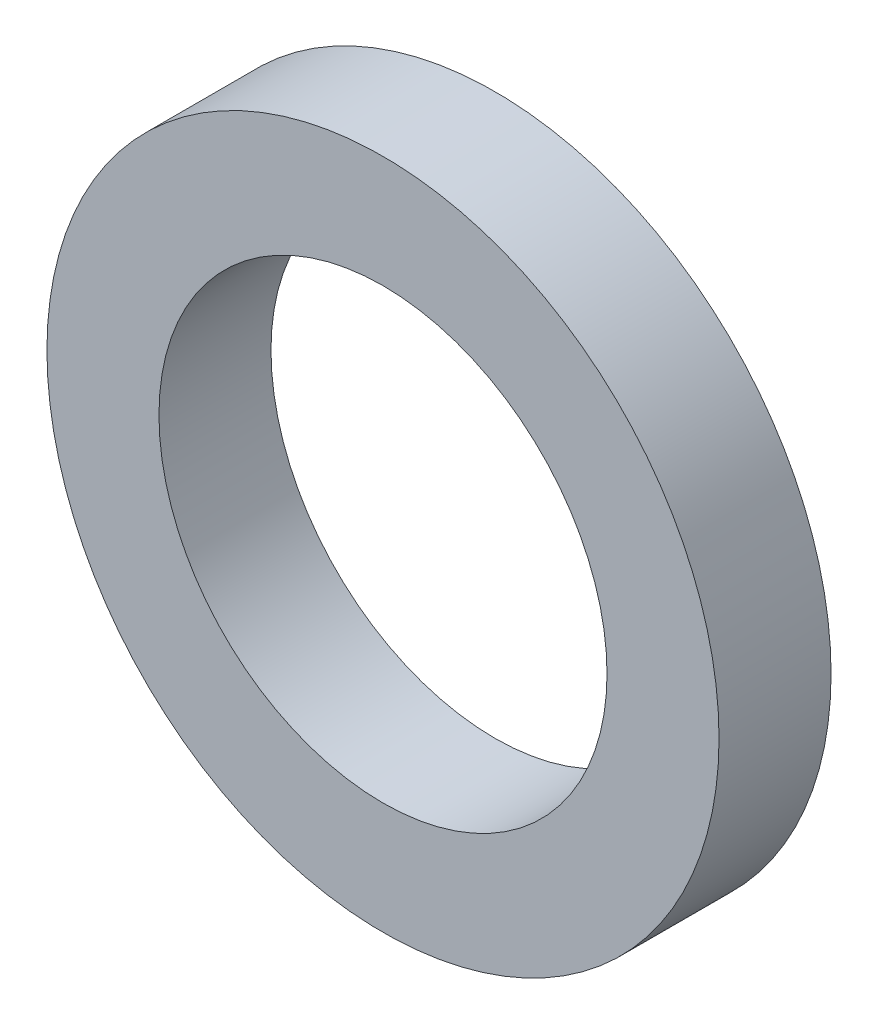
from build123d import *

# Parameters (mm, degrees)
SKETCH1_W = 1
SKETCH1_H = 1


with BuildPart() as part:
    # Sketch1 → Revolve1 (revolve)
    with BuildSketch(Plane(origin=(0, 0, 0), x_dir=(1, 0, 0), z_dir=(0, 1, 0))):
        with Locations((2.5, 0.135)):
            Rectangle(SKETCH1_W, SKETCH1_H)
    revolve(axis=Axis((0, 0, 0.635), (0, 0, -1)))


solid = part.part
